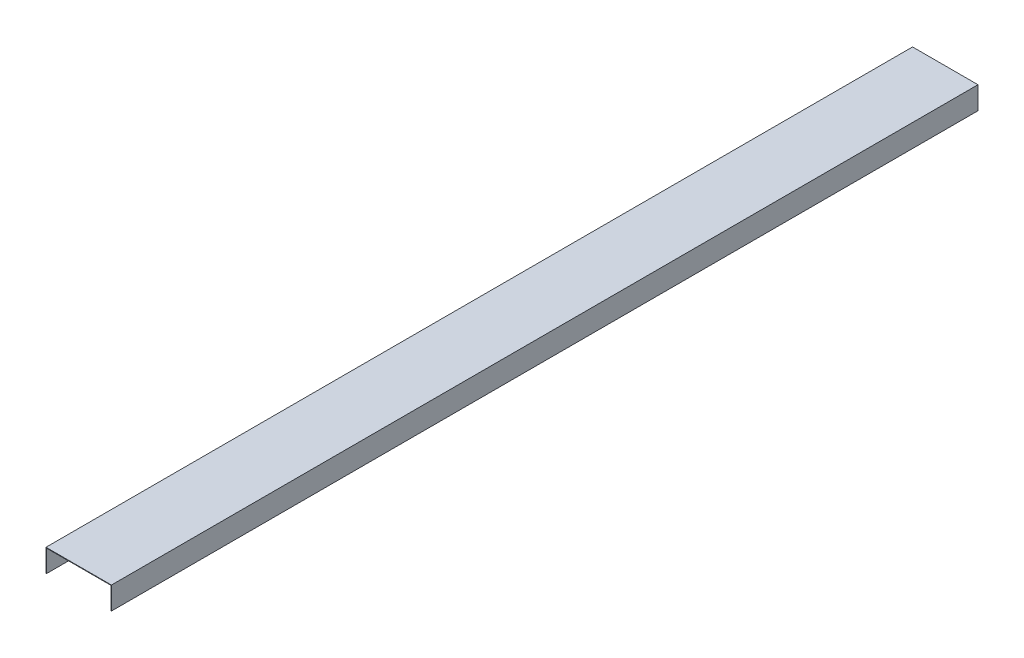
from build123d import *

# Parameters (mm, degrees)
SKETCH1_W           = 92.075
SKETCH1_H           = 1219.2
BOSS_EXTRUDE1_DEPTH = 31.75
SKETCH2_W           = 90.551
SKETCH2_H           = 1219.2
CUT_EXTRUDE1_DEPTH  = 30.988


with BuildPart() as part:
    # Sketch1 → Boss-Extrude1 (new body)
    with BuildSketch(Plane(origin=(0, 0, 0), x_dir=(1, 0, 0), z_dir=(0, 1, 0))):
        Rectangle(SKETCH1_W, SKETCH1_H)
    extrude(amount=BOSS_EXTRUDE1_DEPTH)

    # Sketch2 → Cut-Extrude1 (cut)
    with BuildSketch(Plane(origin=(0, 0, 0), x_dir=(1, 0, 0), z_dir=(0, 1, 0))):
        Rectangle(SKETCH2_W, SKETCH2_H)
    extrude(amount=CUT_EXTRUDE1_DEPTH, mode=Mode.SUBTRACT)


solid = part.part
